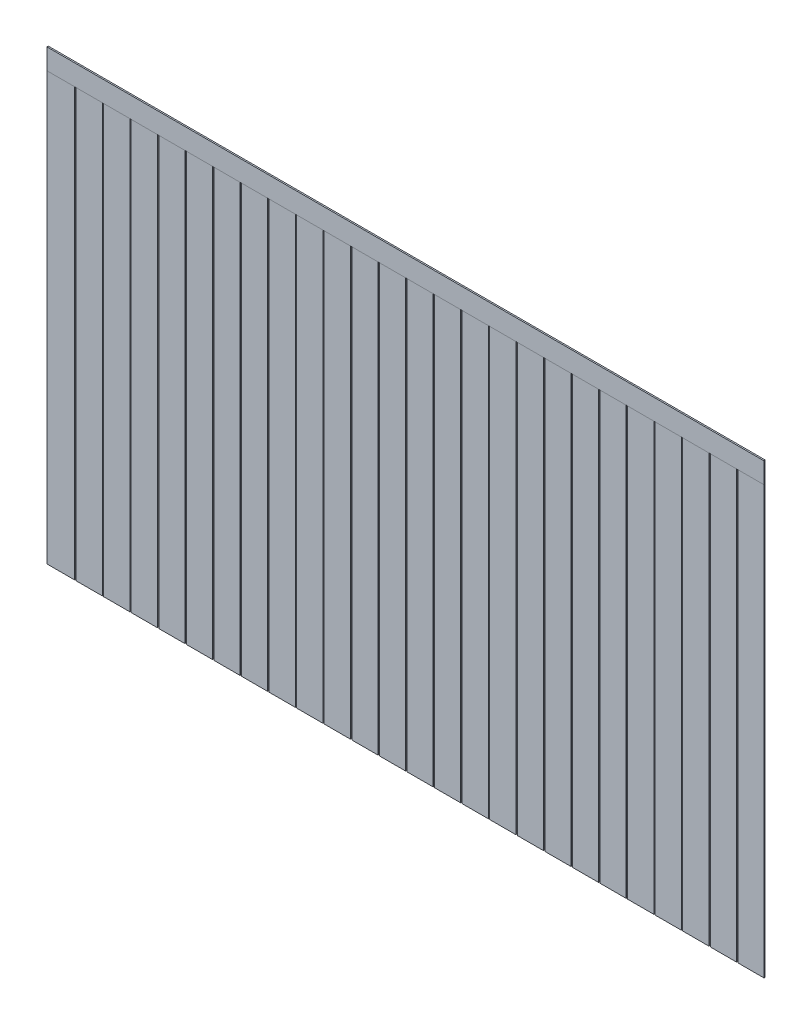
from build123d import *

# Parameters (mm, degrees)
CROQUIS1_W              = 5200
CROQUIS1_H              = 3250
SALIENTE_EXTRUIR1_DEPTH = 10
CROQUIS2_W              = 10
CROQUIS2_H              = 3100
CORTAR_EXTRUIR1_DEPTH   = 10
MATRIZL1_COUNT          = 25
MATRIZL1_PITCH          = 200
CROQUIS4_W              = 5200
CROQUIS4_H              = 3100
CORTAR_EXTRUIR2_DEPTH   = 2
CROQUIS5_W              = 5200
CROQUIS5_H              = 3100
CORTAR_EXTRUIR3_DEPTH   = 2


with BuildPart() as part:
    # Croquis1 → Saliente-Extruir1 (new body)
    with BuildSketch(Plane.XY):
        with Locations((2600, -1625)):
            Rectangle(CROQUIS1_W, CROQUIS1_H)
    extrude(amount=SALIENTE_EXTRUIR1_DEPTH)

    # Croquis2 → Cortar-Extruir1 (cut)
    with BuildSketch(Plane.XY.offset(10)):
        with Locations((205, -1700)):
            Rectangle(CROQUIS2_W, CROQUIS2_H)
    cortar_extruir1 = extrude(amount=-CORTAR_EXTRUIR1_DEPTH, mode=Mode.SUBTRACT)

    # MatrizL1: Cortar-Extruir1 ×25
    with Locations(*[(i * MATRIZL1_PITCH, 0, 0) for i in range(1, MATRIZL1_COUNT)]):
        add(cortar_extruir1, mode=Mode.SUBTRACT)

    # Croquis4 → Cortar-Extruir2 (cut)
    with BuildSketch(Plane.XY.offset(10)):
        with Locations((2600, -1700)):
            Rectangle(CROQUIS4_W, CROQUIS4_H)
    extrude(amount=-CORTAR_EXTRUIR2_DEPTH, mode=Mode.SUBTRACT)

    # Croquis5 → Cortar-Extruir3 (cut)
    with BuildSketch(Plane(origin=(0, 0, 0), x_dir=(-1, 0, 0), z_dir=(0, 0, -1))):
        with Locations((-2600, -1700)):
            Rectangle(CROQUIS5_W, CROQUIS5_H)
    extrude(amount=-CORTAR_EXTRUIR3_DEPTH, mode=Mode.SUBTRACT)


solid = part.part
